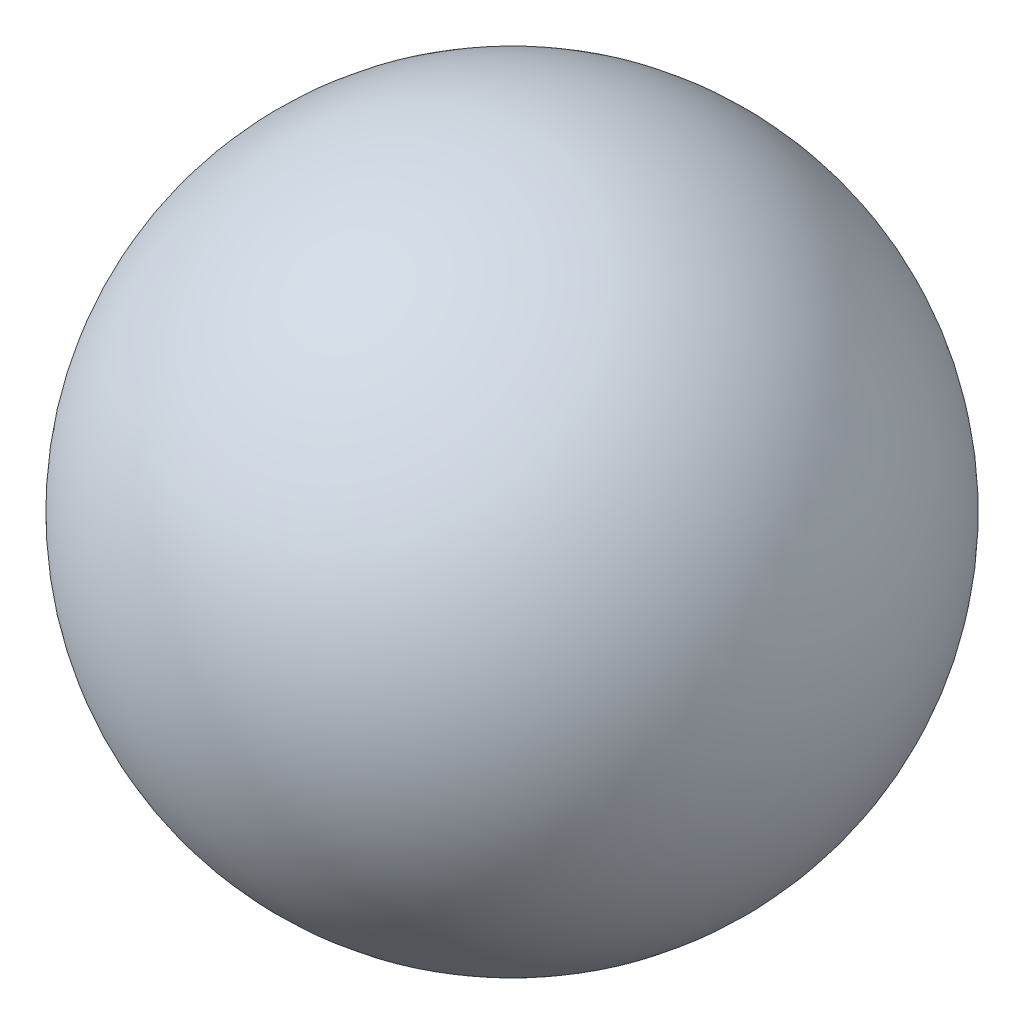
from build123d import *


with BuildPart() as part:
    # Sketch2 → Revolve3 (revolve)
    with BuildSketch(Plane.XY):
        with BuildLine():
            Line((0, 88.9), (0, -88.9))
            ThreePointArc((0, -88.9), (-88.9, 0), (0, 88.9))
        make_face()
    revolve(axis=Axis((0, 88.9, 0), (0, -1, 0)))


solid = part.part
